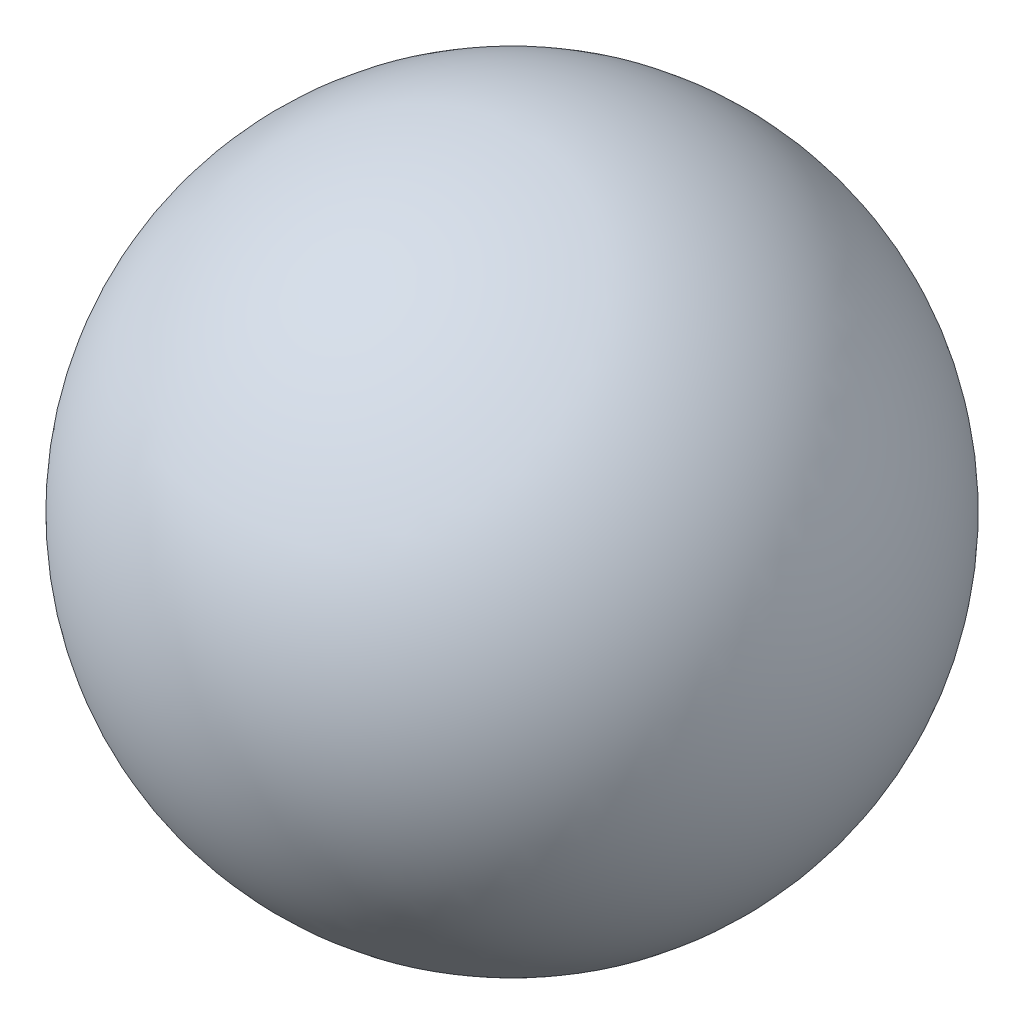
from build123d import *


with BuildPart() as part:
    # Sketch1 → Revolve1 (revolve)
    with BuildSketch(Plane.XY):
        with BuildLine():
            Line((0, 373), (0, 370))
            ThreePointArc((0, 370), (-370, 0), (0, -370))
            Line((0, -370), (0, -373))
            ThreePointArc((0, -373), (-373, 0), (0, 373))
        make_face()
    revolve(axis=Axis((0, -370, 0), (0, -1, 0)))


solid = part.part
